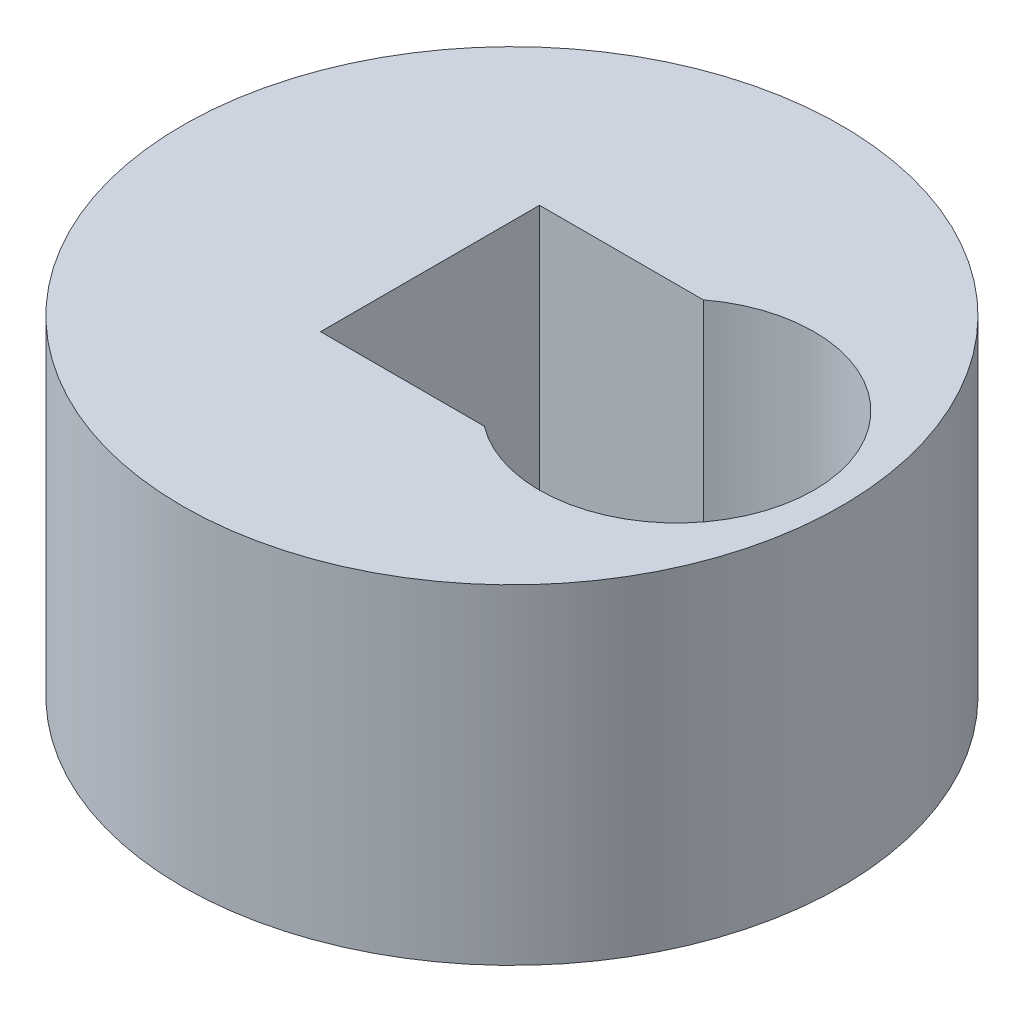
from build123d import *

# Parameters (mm, degrees)
SKETCH_1_R          = 6
SKETCH_1_R_2        = 2.5
EXTRUDE_4_DEPTH     = 6
SKETCH_2_W          = 2.981877758
SKETCH_2_H          = 3.986343956
CUT_EXTRUDE_1_DEPTH = 10


with BuildPart() as part:
    # 草图1 → 凸台-拉伸4 (new body)
    with BuildSketch(Plane(origin=(0, 0, 0), x_dir=(1, 0, 0), z_dir=(0, 1, 0))):
        with Locations(Location((0, 0, 0), (0, 0, 270))):
            Circle(SKETCH_1_R)
        with Locations(Location((3, 0, 0), (0, 0, 270))):
            Circle(SKETCH_1_R_2, mode=Mode.SUBTRACT)
    extrude(amount=EXTRUDE_4_DEPTH)

    # 草图2 → 切除-拉伸1 (cut)
    with BuildSketch(Plane(origin=(0, 6, 0), x_dir=(1, 0, 0), z_dir=(0, 1, 0))):
        Rectangle(SKETCH_2_W, SKETCH_2_H)
    extrude(amount=-CUT_EXTRUDE_1_DEPTH, mode=Mode.SUBTRACT)


solid = part.part
